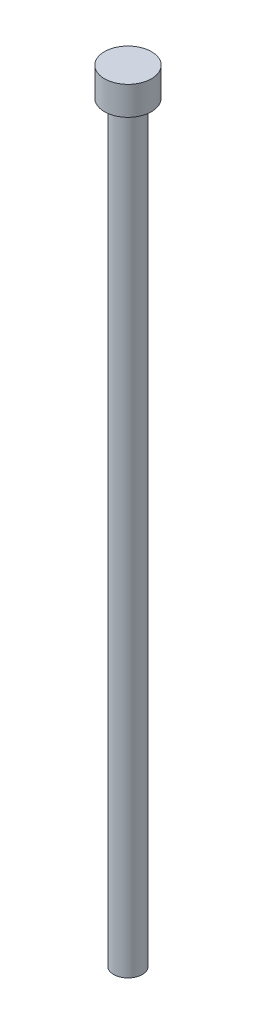
from build123d import *

# Parameters (mm, degrees)
SKETCH1_R           = 3.96875
BOSS_EXTRUDE1_DEPTH = 4.826
SKETCH2_R           = 2.413
BOSS_EXTRUDE2_DEPTH = 127


with BuildPart() as part:
    # Sketch1 → Boss-Extrude1 (new body)
    with BuildSketch(Plane(origin=(0, 0, 0), x_dir=(1, 0, 0), z_dir=(0, 1, 0))):
        with Locations(Location((0, 0, 0), (0, 0, 270))):
            Circle(SKETCH1_R)
    extrude(amount=BOSS_EXTRUDE1_DEPTH)

    # Sketch2 → Boss-Extrude2 (add)
    with BuildSketch(Plane.XZ):
        with Locations(Location((0, 0, 0), (0, 0, 270))):
            Circle(SKETCH2_R)
    extrude(amount=BOSS_EXTRUDE2_DEPTH)


solid = part.part
